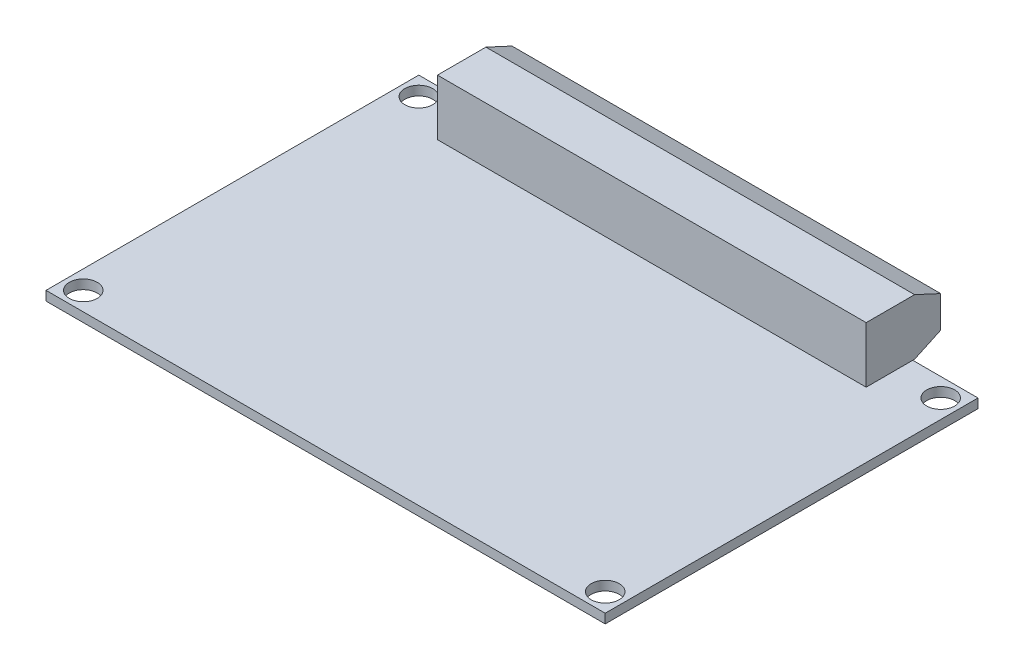
from build123d import *

# Parameters (mm, degrees)
SKETCH1_W           = 60
SKETCH1_H           = 40
BOSS_EXTRUDE1_DEPTH = 0.5
SKETCH2_R           = 1.5
CUT_EXTRUDE1_DEPTH  = 1
SKETCH3_W           = 46
SKETCH3_H           = 8
BOSS_EXTRUDE2_DEPTH = 6
CUT_EXTRUDE2_DEPTH  = 59.139917441


with BuildPart() as part:
    # Sketch1 → Boss-Extrude1 (new, symmetric)
    with BuildSketch(Plane(origin=(0, 0, 0), x_dir=(1, 0, 0), z_dir=(0, 1, 0))):
        Rectangle(SKETCH1_W, SKETCH1_H)
    extrude(amount=BOSS_EXTRUDE1_DEPTH, both=True)

    # Sketch2 → Cut-Extrude1 (cut)
    with BuildSketch(Plane(origin=(0, 0.5, 0), x_dir=(1, 0, 0), z_dir=(0, 1, 0))):
        with Locations(Location((-28, 18, 0), (0, 0, 270))):
            Circle(SKETCH2_R)
        with Locations(Location((28, 18, 0), (0, 0, 90))):
            Circle(SKETCH2_R)
        with Locations(Location((28, -18, 0), (0, 0, 270))):
            Circle(SKETCH2_R)
        with Locations(Location((-28, -18, 0), (0, 0, 90))):
            Circle(SKETCH2_R)
    extrude(amount=-CUT_EXTRUDE1_DEPTH, mode=Mode.SUBTRACT)

    # Sketch3 → Boss-Extrude2 (add)
    with BuildSketch(Plane(origin=(0, 0.5, 0), x_dir=(1, 0, 0), z_dir=(0, 1, 0))):
        with Locations((0, 19)):
            Rectangle(SKETCH3_W, SKETCH3_H)
    extrude(amount=BOSS_EXTRUDE2_DEPTH)

    # Sketch4 → Cut-Extrude2 (cut, through all)
    with BuildSketch(Plane(origin=(23, 0, 0), x_dir=(0, 0, -1), z_dir=(1, 0, 0))):
        Polygon((23, 5.2), (23, 6.5), (20.2, 6.5), align=None)
        Polygon((20.2, 0.5), (23, 1.8), (23, 0.5), align=None)
    extrude(amount=-CUT_EXTRUDE2_DEPTH, mode=Mode.SUBTRACT)


solid = part.part
